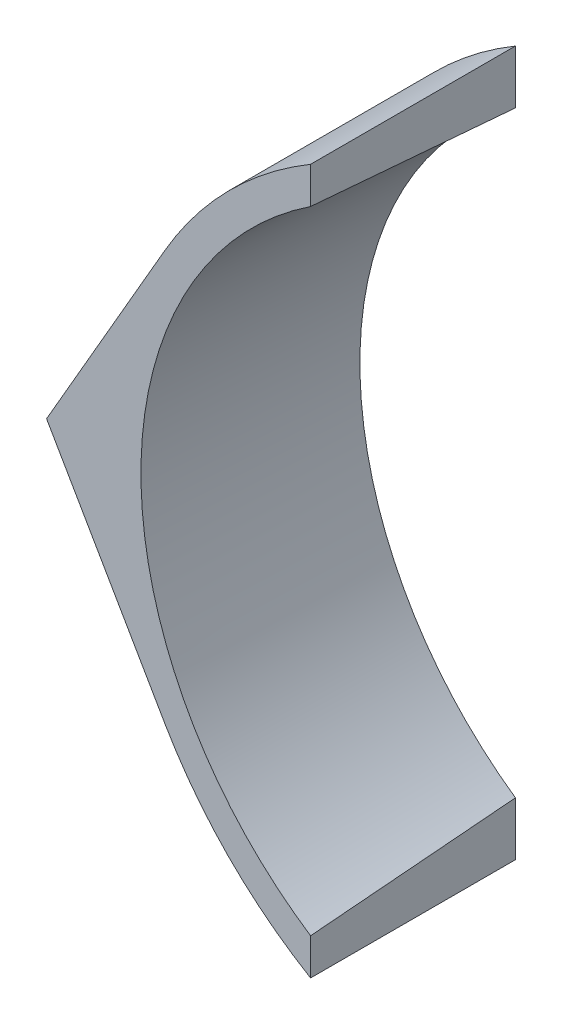
from build123d import *

# Parameters (mm, degrees)
EXTRUDE_1_DEPTH = 10


with BuildPart() as part:
    # 草图1 → 凸台-拉伸1 (new body)
    with BuildSketch(Plane.XY):
        with BuildLine():
            Line((12.110887706, 14.582382064), (12.110887706, 17.199007723))
            ThreePointArc((12.110887706, 17.199007723), (8.091530741, 14.056850277), (4.997932444, 10.000000095))
            Line((4.997932444, 10.000000095), (-0.775570302, 0))
            Line((-0.775570302, 0), (4.99793245, -10.000000104))
            ThreePointArc((4.99793245, -10.000000104), (8.091530745, -14.056850281), (12.110887706, -17.199007723))
            Line((12.110887706, -17.199007723), (12.110887706, -14.582382064))
            ThreePointArc((12.110887706, -14.582382064), (4.518440465, 0), (12.110887706, 14.582382064))
        make_face()
    extrude(amount=EXTRUDE_1_DEPTH)

    # 草图2 → 切除-旋转1 (revolve, cut)
    with BuildSketch(Plane(origin=(0, 0, 0), x_dir=(0, 0, -1), z_dir=(0, -1, 0))):
        Polygon((0, 22.318440465), (0, 4.518440465), (-10, 3.831448348), (-10, 22.318440465), align=None)
    revolve(axis=Axis((22.318440465, 0, 18.306126046), (0, 0, -1)), mode=Mode.SUBTRACT)


solid = part.part
